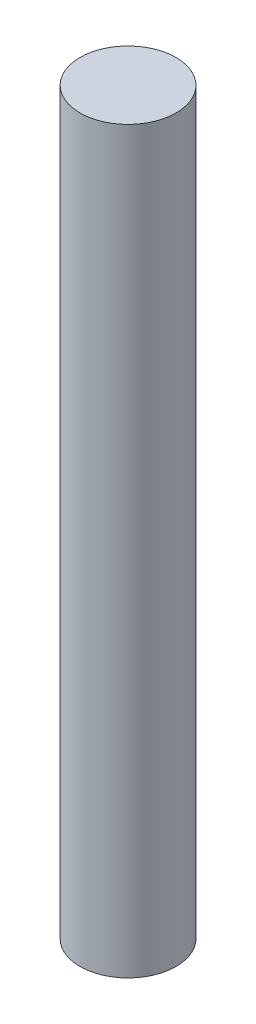
from build123d import *

# Parameters (mm, degrees)
SKETCH1_R           = 2.4765
BOSS_EXTRUDE1_DEPTH = 38.1


with BuildPart() as part:
    # Sketch1 → Boss-Extrude1 (new body)
    with BuildSketch(Plane(origin=(0, 0, 0), x_dir=(1, 0, 0), z_dir=(0, 1, 0))):
        with Locations(Location((0, 0, 0), (0, 0, 90))):
            Circle(SKETCH1_R)
    extrude(amount=BOSS_EXTRUDE1_DEPTH)


solid = part.part
